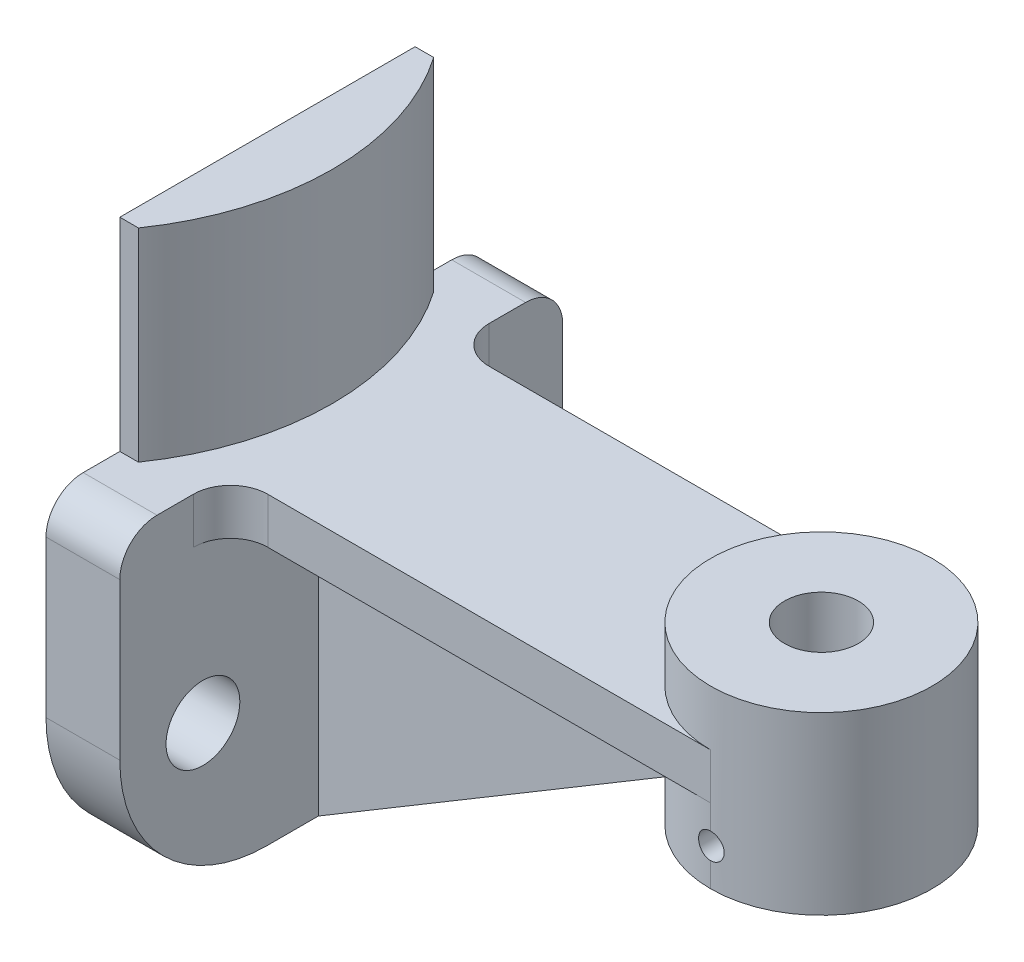
from build123d import *

# Parameters (mm, degrees)
SKETCH1_W               = 76.2
SKETCH1_H               = 58.7
BASE_EXTRUDE_DEPTH      = 12.7
SKETCH2_W               = 38.1
SKETCH2_H               = 7.9
BOSS_EXTRUDE3_DEPTH     = 82.6
SKETCH4_R               = 19.05
BOSS_EXTRUDE4_DEPTH     = 30.2
BOSS_EXTRUDE5_DEPTH     = 34.9
BOSS_EXTRUDE7_DEPTH     = 3.95
SKETCH9_R               = 6.35
CUT_EXTRUDE1_DEPTH      = 158.797726536
SKETCH10_R              = 6.35
CUT_EXTRUDE2_DEPTH      = 154.406657287
CUT_EXTRUDE3_DEPTH      = 153.6056765
CUT_EXTRUDE3_DEPTH_BACK = 153.6056765
SKETCH11_R              = 2.2
FILLET1_R               = 6.4
FILLET2_R               = 25.4


with BuildPart() as part:
    # Sketch1 → Base-Extrude (new body)
    with BuildSketch(Plane(origin=(0, 0, 0), x_dir=(0, 0, -1), z_dir=(1, 0, 0))):
        with Locations((38.1, 29.35)):
            Rectangle(SKETCH1_W, SKETCH1_H)
    extrude(amount=BASE_EXTRUDE_DEPTH)

    # Sketch2 → Boss-Extrude3 (add)
    with BuildSketch(Plane(origin=(12.7, 0, 0), x_dir=(0, 0, -1), z_dir=(1, 0, 0))):
        with Locations((38.1, 54.75)):
            Rectangle(SKETCH2_W, SKETCH2_H)
    extrude(amount=BOSS_EXTRUDE3_DEPTH)

    # Sketch4 → Boss-Extrude4 (add)
    with BuildSketch(Plane(origin=(0, 68.2, 0), x_dir=(-1, 0, 0), z_dir=(0, 1, 0))):
        with Locations(Location((-95.3, -38.1, 0), (0, 0, 90))):
            Circle(SKETCH4_R)
    extrude(amount=-BOSS_EXTRUDE4_DEPTH)

    # Sketch5 → Boss-Extrude5 (add)
    with BuildSketch(Plane(origin=(0, 58.7, 0), x_dir=(-1, 0, 0), z_dir=(0, 1, 0))):
        with BuildLine():
            Line((0, -63.5), (-3.2, -63.5))
            ThreePointArc((-3.2, -63.5), (-11.161116602, -38.1), (-3.2, -12.7))
            Line((-3.2, -12.7), (0, -12.7))
            Line((0, -12.7), (0, -63.5))
        make_face()
    extrude(amount=BOSS_EXTRUDE5_DEPTH)

    # Sketch8 → Boss-Extrude7 (add, symmetric)
    with BuildSketch(Plane(origin=(0, 0, -38.1), x_dir=(-1, 0, 0), z_dir=(0, 0, -1))):
        Polygon((-12.7, 0), (-95.3, 49.391030685), (-95.3, 50.8), (-12.7, 50.8), align=None)
    extrude(amount=BOSS_EXTRUDE7_DEPTH, both=True)

    # Sketch9 → Cut-Extrude1 (cut, through all)
    with BuildSketch(Plane(origin=(12.7, 0, 0), x_dir=(0, 0, -1), z_dir=(1, 0, 0))):
        with Locations((14.3, 23.8)):
            Circle(SKETCH9_R)
        with Locations((61.9, 23.8)):
            Circle(SKETCH9_R)
    extrude(amount=-CUT_EXTRUDE1_DEPTH, mode=Mode.SUBTRACT)

    # Sketch10 → Cut-Extrude2 (cut, through all)
    with BuildSketch(Plane(origin=(0, 68.2, 0), x_dir=(-1, 0, 0), z_dir=(0, 1, 0))):
        with Locations(Location((-95.3, -38.1, 0), (0, 0, 90))):
            Circle(SKETCH10_R)
    extrude(amount=-CUT_EXTRUDE2_DEPTH, mode=Mode.SUBTRACT)

    # Sketch11 → Cut-Extrude3 (cut, two sides: drawn at the far end of the back side and taken through both)
    with BuildSketch(Plane(origin=(0, 0, -38.1), x_dir=(-1, 0, 0), z_dir=(0, 0, -1)).offset(-CUT_EXTRUDE3_DEPTH_BACK)):
        with Locations(Location((-95.3, 44.4, 0), (0, 0, 90))):
            Circle(SKETCH11_R)
    extrude(amount=CUT_EXTRUDE3_DEPTH + CUT_EXTRUDE3_DEPTH_BACK, mode=Mode.SUBTRACT)

    # Fillet1
    fillet1_edges = [part.edges().sort_by_distance(p)[0] for p in [
        (12.7, 54.75, -19.05),
        (12.7, 54.75, -57.15),
        (6.35, 58.7, -76.2),
        (6.35, 58.7, 0),
    ]]
    fillet(fillet1_edges, radius=FILLET1_R)

    # Fillet2
    fillet2_edges = [part.edges().sort_by_distance(p)[0] for p in [
        (6.35, 0, 0),
        (6.35, 0, -76.2),
    ]]
    fillet(fillet2_edges, radius=FILLET2_R)


solid = part.part
